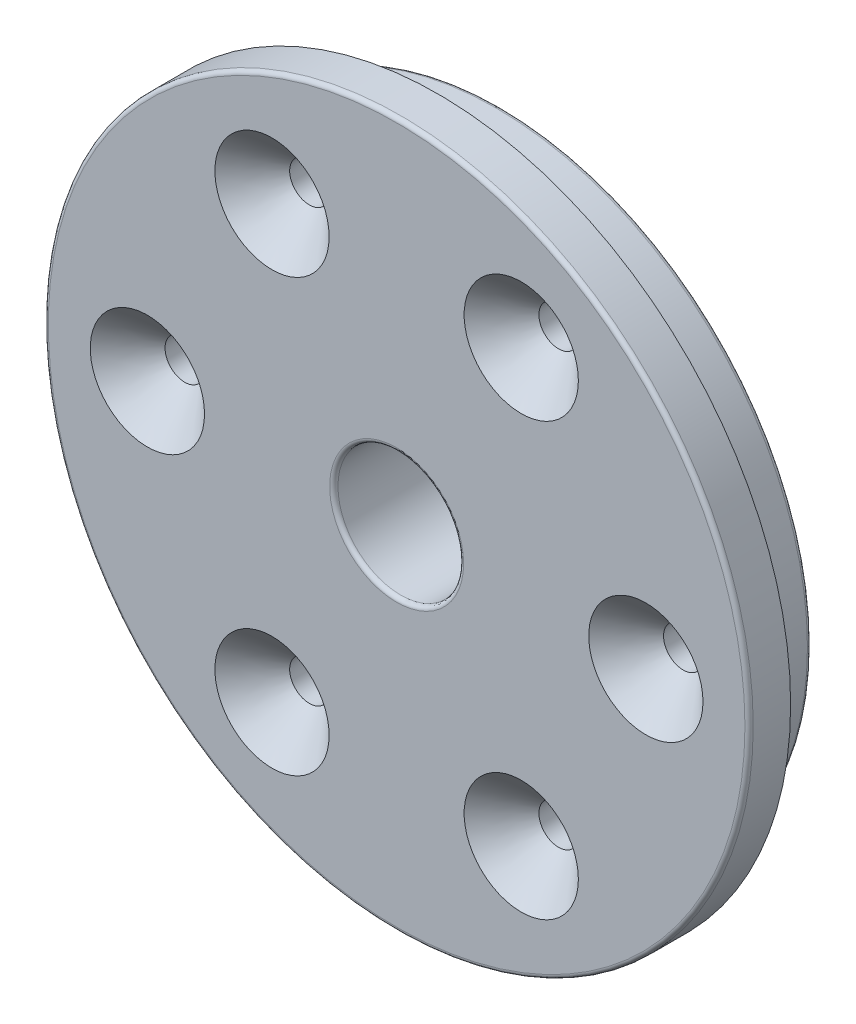
from build123d import *

# Parameters (mm, degrees)
SKETCH_1_R      = 16.97
SKETCH_1_R_2    = 0.95
SKETCH_1_R_3    = 3.025
EXTRUDE_1_DEPTH = 2
EXTRUDE_START   = 3
SKETCH_4_R      = 14.98
SKETCH_4_R_2    = 0.95
SKETCH_4_R_3    = 3.025
EXTRUDE_2_DEPTH = 3
CHAMFER_1_SIZE  = 1.8
EXTRUDE_START_2 = 5
SKETCH_5_R      = 5.025
SKETCH_5_R_2    = 3.025
EXTRUDE_3_DEPTH = 5
FILLET_1_R      = 0.2
FILLET_2_R      = 0.2


with BuildPart() as part:
    # 草图1 → 凸台-拉伸1 (new body)
    with BuildSketch(Plane.XY):
        Circle(SKETCH_1_R)
        with Locations((-12, 0)):
            Circle(SKETCH_1_R_2, mode=Mode.SUBTRACT)
        with Locations((-6, 10.392304845)):
            Circle(SKETCH_1_R_2, mode=Mode.SUBTRACT)
        with Locations((6, 10.392304845)):
            Circle(SKETCH_1_R_2, mode=Mode.SUBTRACT)
        with Locations((12, 0)):
            Circle(SKETCH_1_R_2, mode=Mode.SUBTRACT)
        with Locations((-6, -10.392304845)):
            Circle(SKETCH_1_R_2, mode=Mode.SUBTRACT)
        with Locations((6, -10.392304845)):
            Circle(SKETCH_1_R_2, mode=Mode.SUBTRACT)
        Circle(SKETCH_1_R_3, mode=Mode.SUBTRACT)
    extrude(amount=EXTRUDE_1_DEPTH)

    # 草图4 → 凸台-拉伸2 (add)
    with BuildSketch(Plane(origin=(0, 0, 0), x_dir=(-1, 0, 0), z_dir=(0, 0, -1)).offset(EXTRUDE_START)):
        with Locations(Location((0, 0, 0), (0, 0, 270))):
            Circle(SKETCH_4_R)
        with Locations(Location((6, 10.392304845, 0), (0, 0, 270))):
            Circle(SKETCH_4_R_2, mode=Mode.SUBTRACT)
        with Locations(Location((12, 0, 0), (0, 0, 270))):
            Circle(SKETCH_4_R_2, mode=Mode.SUBTRACT)
        with Locations(Location((6, -10.392304845, 0), (0, 0, 270))):
            Circle(SKETCH_4_R_2, mode=Mode.SUBTRACT)
        with Locations(Location((-6, -10.392304845, 0), (0, 0, 270))):
            Circle(SKETCH_4_R_2, mode=Mode.SUBTRACT)
        with Locations(Location((-12, 0, 0), (0, 0, 270))):
            Circle(SKETCH_4_R_2, mode=Mode.SUBTRACT)
        with Locations(Location((-6, 10.392304845, 0), (0, 0, 270))):
            Circle(SKETCH_4_R_2, mode=Mode.SUBTRACT)
        with Locations(Location((0, 0, 0), (0, 0, 270))):
            Circle(SKETCH_4_R_3, mode=Mode.SUBTRACT)
    extrude(amount=-EXTRUDE_2_DEPTH)

    # 倒角1
    chamfer_1_edges = [part.edges().sort_by_distance(p)[0] for p in [
        (5.05, 10.392304845, 2),
        (11.05, 0, 2),
        (-6.95, -10.392304845, 2),
        (5.05, -10.392304845, 2),
        (-12.95, 0, 2),
        (-6.95, 10.392304845, 2),
    ]]
    chamfer(chamfer_1_edges, length=CHAMFER_1_SIZE)

    # 草图5 → 凸台-拉伸3 (add)
    with BuildSketch(Plane(origin=(0, 0, -3), x_dir=(-1, 0, 0), z_dir=(0, 0, -1)).offset(EXTRUDE_START_2)):
        with Locations(Location((0, 0, 0), (0, 0, 270))):
            Circle(SKETCH_5_R)
        Circle(SKETCH_5_R_2, mode=Mode.SUBTRACT)
    extrude(amount=-EXTRUDE_3_DEPTH)

    # 圆角1
    fillet_1_edges = [part.edges().sort_by_distance(p)[0] for p in [
        (0, 14.98, 0),
    ]]
    fillet(fillet_1_edges, radius=FILLET_1_R)

    # 圆角2
    fillet_2_edges = [part.edges().sort_by_distance(p)[0] for p in [
        (-3.025, 0, 2),
        (0, 14.98, -3),
        (-16.97, 0, 2),
        (0, 5.025, -8),
        (3.025, 0, -8),
    ]]
    fillet(fillet_2_edges, radius=FILLET_2_R)


solid = part.part
